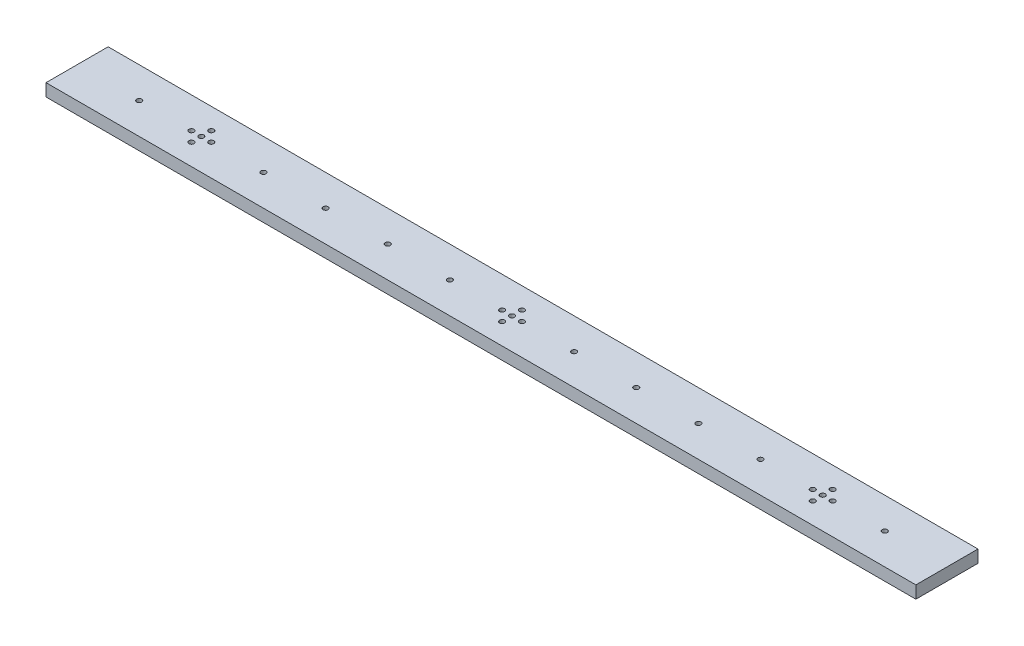
from build123d import *

# Parameters (mm, degrees)
SKETCH_1_W          = 700
SKETCH_1_H          = 50
EXTRUDE_1_DEPTH     = 10
SKETCH_2_R          = 2.05
CUT_EXTRUDE_2_DEPTH = 352.034186369
SKETCH_3_R          = 2.05
CUT_EXTRUDE_3_DEPTH = 352.034186369


with BuildPart() as part:
    # 草图1 → 凸台-拉伸1 (new body)
    with BuildSketch(Plane(origin=(0, 0, 0), x_dir=(1, 0, 0), z_dir=(0, 1, 0))):
        Rectangle(SKETCH_1_W, SKETCH_1_H)
    extrude(amount=EXTRUDE_1_DEPTH)

    # 草图2 → 切除-拉伸2 (cut, through all)
    with BuildSketch(Plane(origin=(0, 10, 0), x_dir=(1, 0, 0), z_dir=(0, 1, 0))):
        with Locations(Location((-300, 0, 0), (0, 0, 270))):
            Circle(SKETCH_2_R)
        with Locations(Location((-250, 0, 0), (0, 0, 270))):
            Circle(SKETCH_2_R)
        with Locations(Location((-200, 0, 0), (0, 0, 270))):
            Circle(SKETCH_2_R)
        with Locations(Location((-150, 0, 0), (0, 0, 270))):
            Circle(SKETCH_2_R)
        with Locations(Location((-100, 0, 0), (0, 0, 270))):
            Circle(SKETCH_2_R)
        with Locations(Location((-50, 0, 0), (0, 0, 270))):
            Circle(SKETCH_2_R)
        with Locations(Location((0, 0, 0), (0, 0, 270))):
            Circle(SKETCH_2_R)
        with Locations(Location((50, 0, 0), (0, 0, 270))):
            Circle(SKETCH_2_R)
        with Locations(Location((100, 0, 0), (0, 0, 270))):
            Circle(SKETCH_2_R)
        with Locations(Location((150, 0, 0), (0, 0, 270))):
            Circle(SKETCH_2_R)
        with Locations(Location((200, 0, 0), (0, 0, 270))):
            Circle(SKETCH_2_R)
        with Locations(Location((250, 0, 0), (0, 0, 270))):
            Circle(SKETCH_2_R)
        with Locations(Location((300, 0, 0), (0, 0, 270))):
            Circle(SKETCH_2_R)
    extrude(amount=-CUT_EXTRUDE_2_DEPTH, mode=Mode.SUBTRACT)

    # 草图3 → 切除-拉伸3 (cut, through all)
    with BuildSketch(Plane(origin=(0, 10, 0), x_dir=(1, 0, 0), z_dir=(0, 1, 0))):
        with Locations(Location((-242, 0, 0), (0, 0, 270))):
            Circle(SKETCH_3_R)
        with Locations(Location((-258, 0, 0), (0, 0, 270))):
            Circle(SKETCH_3_R)
        with Locations(Location((-8, 0, 0), (0, 0, 270))):
            Circle(SKETCH_3_R)
        with Locations(Location((8, 0, 0), (0, 0, 270))):
            Circle(SKETCH_3_R)
        with Locations(Location((242, 0, 0), (0, 0, 270))):
            Circle(SKETCH_3_R)
        with Locations(Location((258, 0, 0), (0, 0, 270))):
            Circle(SKETCH_3_R)
        with Locations(Location((-250, 8, 0), (0, 0, 270))):
            Circle(SKETCH_3_R)
        with Locations(Location((-250, -8, 0), (0, 0, 270))):
            Circle(SKETCH_3_R)
        with Locations(Location((0, 8, 0), (0, 0, 270))):
            Circle(SKETCH_3_R)
        with Locations(Location((0, -8, 0), (0, 0, 270))):
            Circle(SKETCH_3_R)
        with Locations(Location((250, 8, 0), (0, 0, 270))):
            Circle(SKETCH_3_R)
        with Locations(Location((250, -8, 0), (0, 0, 270))):
            Circle(SKETCH_3_R)
    extrude(amount=-CUT_EXTRUDE_3_DEPTH, mode=Mode.SUBTRACT)


solid = part.part
